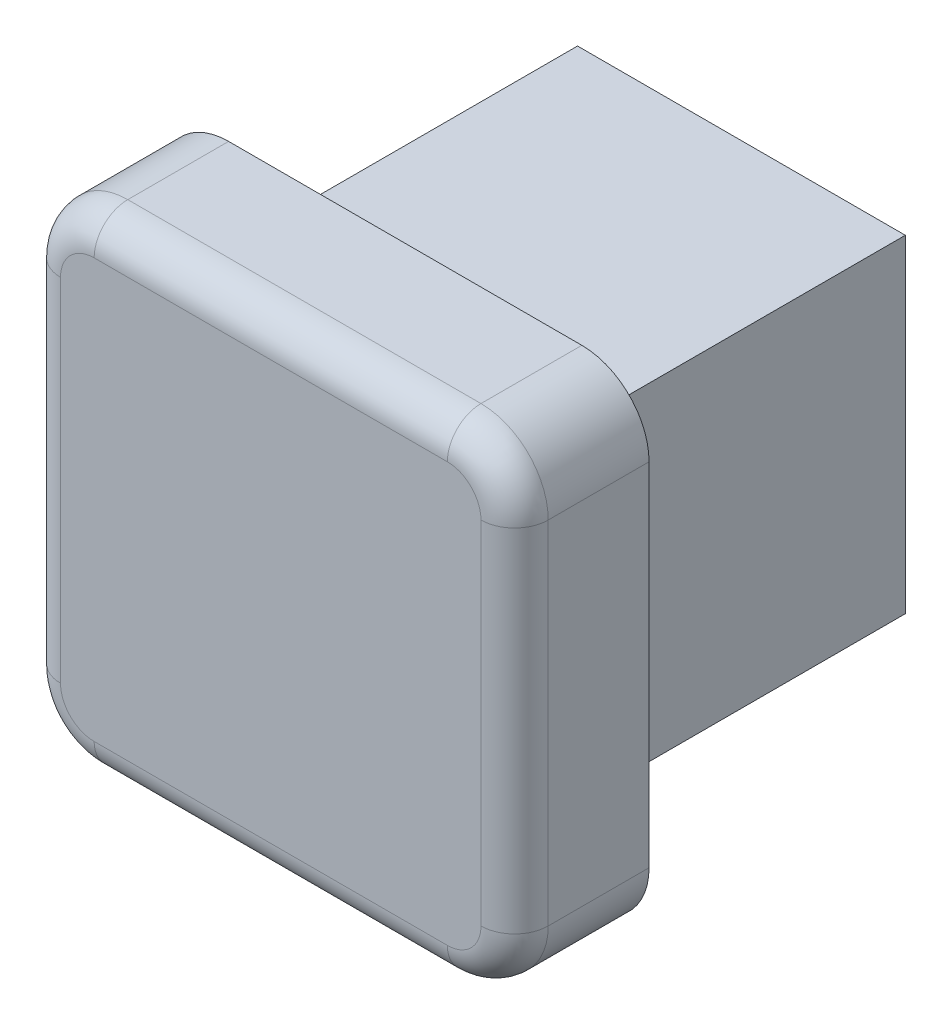
from build123d import *

# Parameters (mm, degrees)
SKETCH1_W           = 9.75
SKETCH1_H           = 9.75
SKETCH1_W_2         = 7.75
SKETCH1_H_2         = 7.75
BOSS_EXTRUDE1_DEPTH = 10
BOSS_EXTRUDE2_DEPTH = 4
FILLET1_R           = 1


with BuildPart() as part:
    # Sketch1 → Boss-Extrude1 (new body)
    with BuildSketch(Plane.XY):
        Rectangle(SKETCH1_W, SKETCH1_H)
        Rectangle(SKETCH1_W_2, SKETCH1_H_2, mode=Mode.SUBTRACT)
    extrude(amount=BOSS_EXTRUDE1_DEPTH)

    # Sketch2 → Boss-Extrude2 (add)
    with BuildSketch(Plane.XY.offset(10)):
        with BuildLine():
            Line((-5.253161089, 7.228716278), (5.253161089, 7.228716278))
            ThreePointArc((5.253161089, 7.228716278), (6.667374652, 6.64292984), (7.253161089, 5.228716278))
            Line((7.253161089, 5.228716278), (7.253161089, -5.228716278))
            ThreePointArc((7.253161089, -5.228716278), (6.667374652, -6.64292984), (5.253161089, -7.228716278))
            Line((5.253161089, -7.228716278), (-5.253161089, -7.228716278))
            ThreePointArc((-5.253161089, -7.228716278), (-6.667374652, -6.64292984), (-7.253161089, -5.228716278))
            Line((-7.253161089, -5.228716278), (-7.253161089, 5.228716278))
            ThreePointArc((-7.253161089, 5.228716278), (-6.667374652, 6.64292984), (-5.253161089, 7.228716278))
        make_face()
    extrude(amount=BOSS_EXTRUDE2_DEPTH)

    # Fillet1
    fillet1_edges = [part.edges().sort_by_distance(p)[0] for p in [
        (6.667374652, 6.64292984, 14),
        (0, 7.228716278, 14),
        (-6.667374652, 6.64292984, 14),
        (-7.253161089, 0, 14),
        (-6.667374652, -6.64292984, 14),
        (0, -7.228716278, 14),
        (6.667374652, -6.64292984, 14),
        (7.253161089, 0, 14),
    ]]
    fillet(fillet1_edges, radius=FILLET1_R)


solid = part.part
